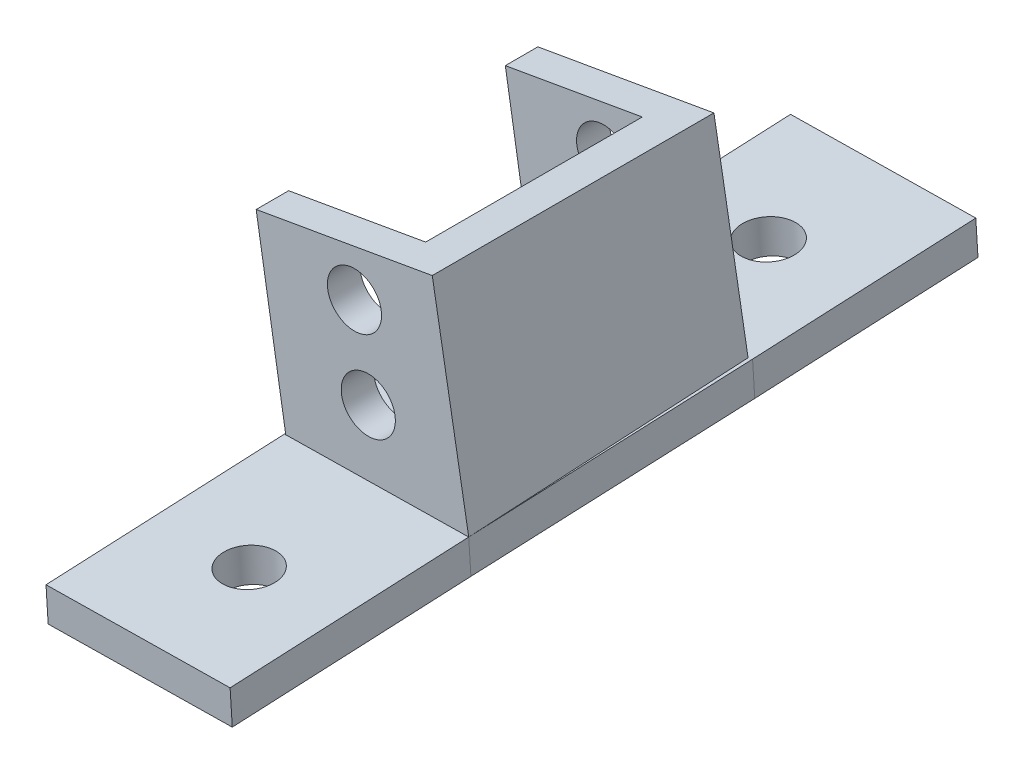
from build123d import *

# Parameters (mm, degrees)
BOSS_EXTRUDE1_DEPTH = 29.21
SKETCH2_R           = 3.175
BOSS_EXTRUDE2_DEPTH = 3.81
BOSS_EXTRUDE3_START = -3.81
SKETCH3_R           = 3.175
BOSS_EXTRUDE3_DEPTH = 3.81
SKETCH4_R           = 3.162370232
SKETCH4_R_2         = 3.091345033
BOSS_EXTRUDE4_DEPTH = 4.064


with BuildPart() as part:
    # Sketch1 → Boss-Extrude1 (new body)
    with BuildSketch(Plane.XY):
        with BuildLine():
            Line((458.862647092, 254.521445295), (448.165127061, 252.766085749))
            Line((448.165127061, 252.766085749), (448.484233443, 250.943633746))
            Line((448.484233443, 250.943633746), (469.389805578, 254.604142486))
            Line((469.389805578, 254.604142486), (465.115245634, 279.016629277))
            Line((465.115245634, 279.016629277), (460.527946701, 278.213405728))
            ThreePointArc((460.527946701, 278.213405728), (463.226929453, 274.636254744), (463.477224231, 270.162121354))
            ThreePointArc((463.477224231, 270.162121354), (463.399405765, 268.135304283), (464.120754615, 266.239598875))
            ThreePointArc((464.120754615, 266.239598875), (464.640877411, 258.967440337), (458.862647092, 254.521445295))
        make_face()
    extrude(amount=-BOSS_EXTRUDE1_DEPTH)

    # Sketch2 → Boss-Extrude2 (add)
    with BuildSketch(Plane.XY):
        Polygon((465.115245634, 279.016629277), (469.389805578, 254.604142486), (448.484233443, 250.943633746), (444.470875732, 275.401856337), align=None)
        with Locations((457.615851502, 262.119672583)):
            Circle(SKETCH2_R, mode=Mode.SUBTRACT)
        with Locations((455.996603091, 271.987703521)):
            Circle(SKETCH2_R, mode=Mode.SUBTRACT)
    extrude(amount=BOSS_EXTRUDE2_DEPTH)

    # Sketch3 → Boss-Extrude3 (add)
    with BuildSketch(Plane(origin=(0, 0, -29.21), x_dir=(-1, 0, 0), z_dir=(0, 0, -1)).offset(BOSS_EXTRUDE3_START)):
        with BuildLine():
            Line((-460.527946701, 278.213405728), (-444.470875732, 275.401856337))
            Line((-444.470875732, 275.401856337), (-448.165127061, 252.766085749))
            Line((-448.165127061, 252.766085749), (-458.862647092, 254.521445295))
            ThreePointArc((-458.862647092, 254.521445295), (-464.640877411, 258.967440337), (-464.120754615, 266.239598875))
            ThreePointArc((-464.120754615, 266.239598875), (-463.399405765, 268.135304283), (-463.477224231, 270.162121354))
            ThreePointArc((-463.477224231, 270.162121354), (-463.226929453, 274.636254744), (-460.527946701, 278.213405728))
        make_face()
        with Locations(Location((-457.615851502, 262.119672583, 0), (0, 0, 180))):
            Circle(SKETCH3_R, mode=Mode.SUBTRACT)
        with Locations(Location((-455.996603091, 271.987703521, 0), (0, 0, 180))):
            Circle(SKETCH3_R, mode=Mode.SUBTRACT)
    extrude(amount=BOSS_EXTRUDE3_DEPTH)

    # Sketch4 → Boss-Extrude4 (add)
    with BuildSketch(Plane(origin=(-3.919475367, 246.715707824, 11.636685294), x_dir=(0.9998741117550616, 0.01584934704377867, 0.0007475562269396132), z_dir=(-0.01586696700779868, 0.9987637706378837, 0.047108065330370395))):
        Polygon((451.768985456, 41.36328589), (451.768985456, 67.563393238), (473.507185402, 67.563393238), (473.507185402, 41.36328589), (473.368872521, 8.189649592), (473.368872521, -19.816380435), (451.768985456, -19.816380435), align=None)
        with Locations(Location((462.696745397, 54.030860165, 0), (0, 0, 270))):
            Circle(SKETCH4_R, mode=Mode.SUBTRACT)
        with Locations(Location((462.696745397, -6.905130234, 0), (0, 0, 270))):
            Circle(SKETCH4_R_2, mode=Mode.SUBTRACT)
    extrude(amount=-BOSS_EXTRUDE4_DEPTH)


solid = part.part
